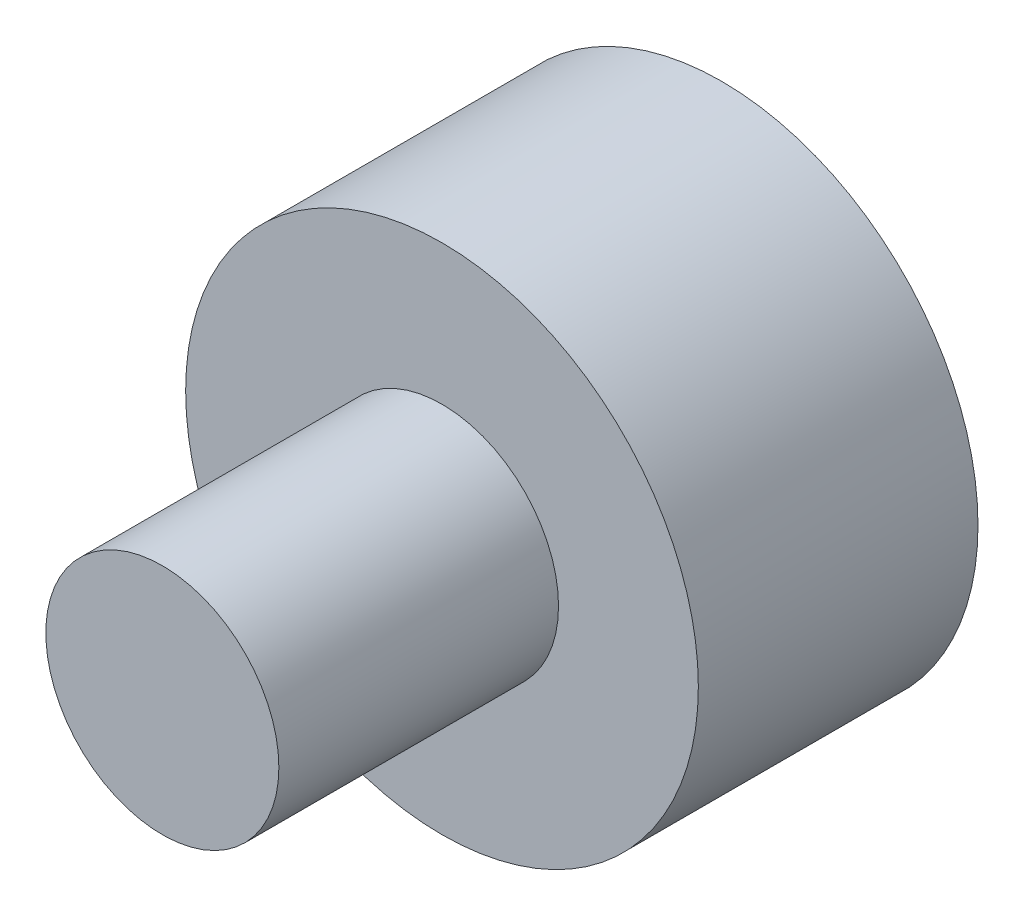
from build123d import *

# Parameters (mm, degrees)
SKETCH_1_R      = 2.75
EXTRUDE_1_DEPTH = 3
SKETCH_2_R      = 1.25
EXTRUDE_2_DEPTH = 3


with BuildPart() as part:
    # 草图1 → 凸台-拉伸1 (new body)
    with BuildSketch(Plane.XY):
        Circle(SKETCH_1_R)
    extrude(amount=EXTRUDE_1_DEPTH)

    # 草图2 → 凸台-拉伸2 (add)
    with BuildSketch(Plane.XY.offset(3)):
        Circle(SKETCH_2_R)
    extrude(amount=EXTRUDE_2_DEPTH)


solid = part.part
